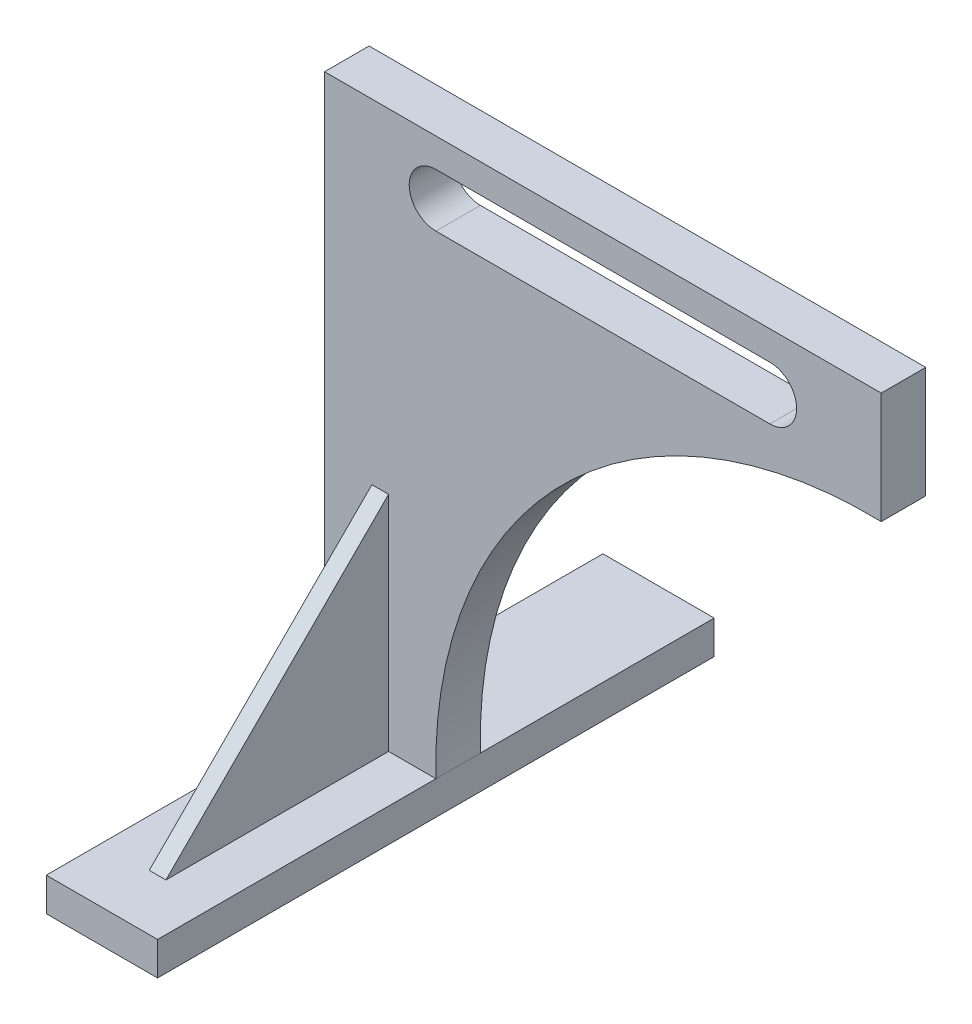
from build123d import *

# Parameters (mm, degrees)
SKETCH1_W           = 50
SKETCH1_H           = 15
BOSS_EXTRUDE1_DEPTH = 250
BOSS_EXTRUDE3_START = -135
BOSS_EXTRUDE3_DEPTH = 10
BOSS_EXTRUDE4_DEPTH = 3.75
CUT_EXTRUDE1_DEPTH  = 365.082751583


with BuildPart() as part:
    # Sketch1 → Boss-Extrude1 (new body)
    with BuildSketch(Plane.XY):
        Rectangle(SKETCH1_W, SKETCH1_H)
    extrude(amount=-BOSS_EXTRUDE1_DEPTH)

    # Sketch2 → Boss-Extrude3 (add, symmetric)
    with BuildSketch(Plane.XY.offset(BOSS_EXTRUDE3_START)):
        with BuildLine():
            Line((-25, 7.5), (-25, 257.5))
            Line((-25, 257.5), (225, 257.5))
            Line((225, 257.5), (225, 207.5))
            ThreePointArc((225, 207.5), (82.048365399, 150.451634601), (25, 7.5))
            Line((25, 7.5), (-25, 7.5))
        make_face()
    extrude(amount=BOSS_EXTRUDE3_DEPTH, both=True)

    # Sketch4 → Boss-Extrude4 (add, symmetric)
    with BuildSketch(Plane(origin=(0, 0, 0), x_dir=(0, 0, -1), z_dir=(1, 0, 0))):
        Polygon((25, 7.5), (125, 107.5), (125, 7.5), align=None)
    extrude(amount=BOSS_EXTRUDE4_DEPTH, both=True)

    # Sketch5 → Cut-Extrude1 (cut, through all)
    with BuildSketch(Plane.XY.offset(-125)):
        with BuildLine():
            Line((25, 244.5), (175, 244.5))
            ThreePointArc((175, 244.5), (187, 232.5), (175, 220.5))
            Line((175, 220.5), (25, 220.5))
            ThreePointArc((25, 220.5), (13, 232.5), (25, 244.5))
        make_face()
    extrude(amount=-CUT_EXTRUDE1_DEPTH, mode=Mode.SUBTRACT)


solid = part.part
